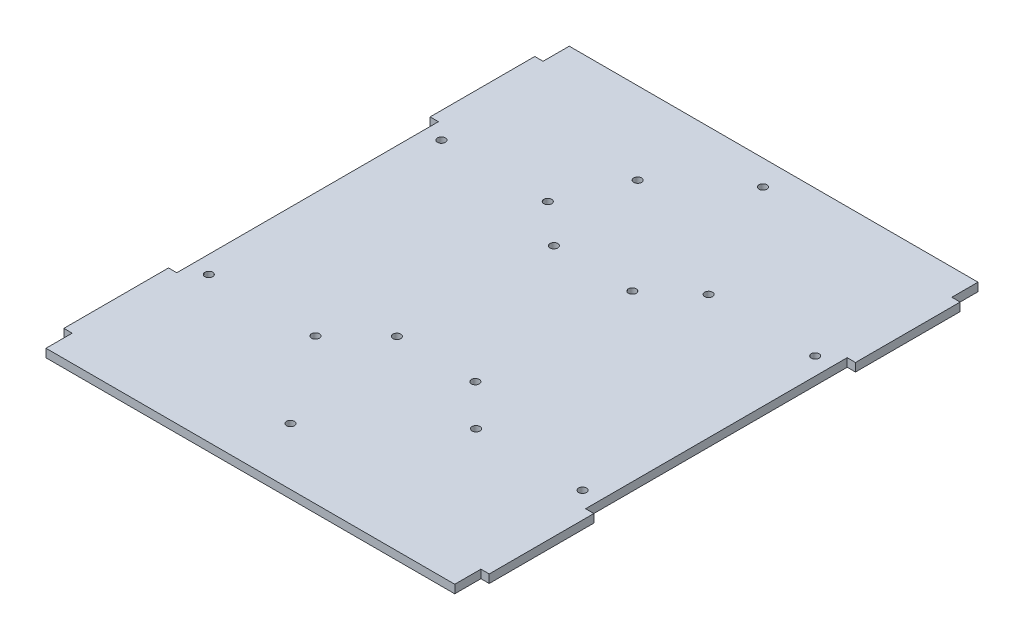
from build123d import *

# Parameters (mm, degrees)
BOSS_EXTRUDE1_DEPTH      = 3.175
F_1_0_1_DIAMETER_HOLE1_D = 3
F_3_0_3_DIAMETER_HOLE1_D = 3


with BuildPart() as part:
    # Sketch1 → Boss-Extrude1 (new body)
    with BuildSketch(Plane(origin=(0, 0, 0), x_dir=(1, 0, 0), z_dir=(0, 1, 0))):
        Polygon((0, 190), (-3.175, 190), (-3.175, 150), (0, 150), (0, 50), (-3.175, 50), (-3.175, 10), (0, 10), (0, 0), (156.24, 0), (156.24, 10), (159.415, 10), (159.415, 50), (156.24, 50), (156.24, 150), (159.415, 150), (159.415, 190), (156.24, 190), (156.24, 200), (0, 200), align=None)
    extrude(amount=BOSS_EXTRUDE1_DEPTH)

    # Ø1.0 (1) Diameter Hole1 (through all)
    with Locations(Plane(origin=(0, 3.175, 0), x_dir=(1, 0, 0), z_dir=(0, 1, 0))):
        with Locations((47.327548064, 144.467472705), (6.682102799, 144.467472705), (57.426953427, 168.726839726), (83.629599498, 190.400856446), (108.822249068, 144.454220349), (149.551998107, 144.454220349), (47.417498943, 55.54499618), (108.822508358, 55.54499618), (149.552467088, 55.54499618), (71.619997678, 21.799999041), (6.6874813, 55.54499618)):
            Hole(F_1_0_1_DIAMETER_HOLE1_D / 2)

    # Ø3.0 (3) Diameter Hole1 (through all)
    with Locations(Plane(origin=(0, 3.175, 0), x_dir=(1, 0, 0), z_dir=(0, 1, 0))):
        with Locations((63.121282677, 131.000354826), (93.119995544, 130.999996355), (63.121282677, 71.000354826), (93.119995544, 70.999996355)):
            Hole(F_3_0_3_DIAMETER_HOLE1_D / 2)


solid = part.part
